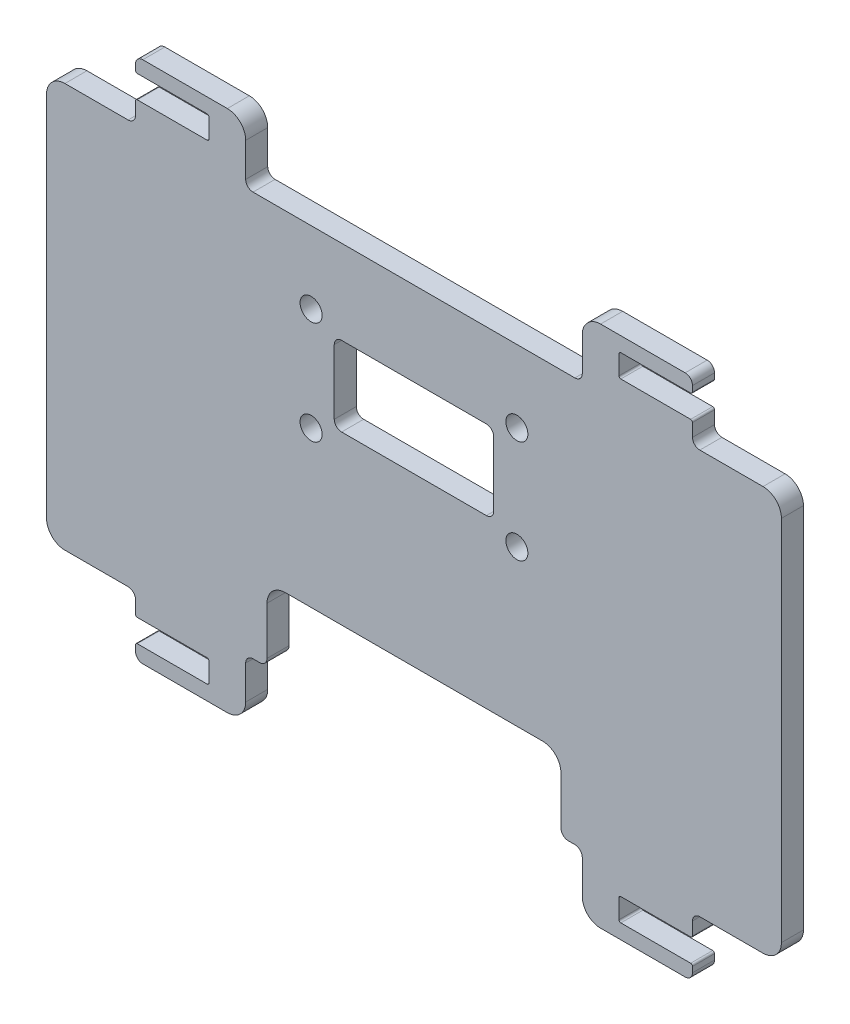
from build123d import *

# Parameters (mm, degrees)
CROQUIS1_R              = 1.5
CROQUIS1_W              = 21.7
CROQUIS1_H              = 10.8
SALIENTE_EXTRUIR1_DEPTH = 3
CORTAR_EXTRUIR2_DEPTH   = 3
REDONDEO1_R             = 1
REDONDEO2_R             = 0.25


with BuildPart() as part:
    # Croquis1 → Saliente-Extruir1 (new body)
    with BuildSketch(Plane.XY):
        with BuildLine():
            Line((-50, 25), (-50, -25))
            ThreePointArc((-50, -25), (-49.267766953, -26.767766953), (-47.5, -27.5))
            Line((-47.5, -27.5), (-37.9, -27.5))
            Line((-37.9, -27.5), (-37.9, -30.5))
            Line((-37.9, -30.5), (-27.9, -30.5))
            Line((-27.9, -30.5), (-27.9, -33.6))
            Line((-27.9, -33.6), (-37.9, -33.6))
            Line((-37.9, -33.6), (-37.9, -35.6))
            Line((-37.9, -35.6), (-25.4, -35.6))
            ThreePointArc((-25.4, -35.6), (-23.632233047, -34.867766953), (-22.9, -33.1))
            Line((-22.9, -33.1), (-22.9, -27.5))
            Line((-22.9, -27.5), (22.9, -27.5))
            Line((22.9, -27.5), (22.9, -33.1))
            ThreePointArc((22.9, -33.1), (23.632233047, -34.867766953), (25.4, -35.6))
            Line((25.4, -35.6), (37.9, -35.6))
            Line((37.9, -35.6), (37.9, -33.6))
            Line((37.9, -33.6), (27.9, -33.6))
            Line((27.9, -33.6), (27.9, -30.5))
            Line((27.9, -30.5), (37.9, -30.5))
            Line((37.9, -30.5), (37.9, -27.5))
            Line((37.9, -27.5), (47.5, -27.5))
            ThreePointArc((47.5, -27.5), (49.267766953, -26.767766953), (50, -25))
            Line((50, -25), (50, 25))
            ThreePointArc((50, 25), (49.267766953, 26.767766953), (47.5, 27.5))
            Line((47.5, 27.5), (37.9, 27.5))
            Line((37.9, 27.5), (37.9, 30.5))
            Line((37.9, 30.5), (27.9, 30.5))
            Line((27.9, 30.5), (27.9, 33.6))
            Line((27.9, 33.6), (37.9, 33.6))
            Line((37.9, 33.6), (37.9, 35.6))
            Line((37.9, 35.6), (25.4, 35.6))
            ThreePointArc((25.4, 35.6), (23.632233047, 34.867766953), (22.9, 33.1))
            Line((22.9, 33.1), (22.9, 27.5))
            Line((22.9, 27.5), (-22.9, 27.5))
            Line((-22.9, 27.5), (-22.9, 33.1))
            ThreePointArc((-22.9, 33.1), (-23.632233047, 34.867766953), (-25.4, 35.6))
            Line((-25.4, 35.6), (-37.9, 35.6))
            Line((-37.9, 35.6), (-37.9, 33.6))
            Line((-37.9, 33.6), (-27.9, 33.6))
            Line((-27.9, 33.6), (-27.9, 30.5))
            Line((-27.9, 30.5), (-37.9, 30.5))
            Line((-37.9, 30.5), (-37.9, 27.5))
            Line((-37.9, 27.5), (-47.5, 27.5))
            ThreePointArc((-47.5, 27.5), (-49.267766953, 26.767766953), (-50, 25))
        make_face()
        with Locations((-14, 17.663397979)):
            Circle(CROQUIS1_R, mode=Mode.SUBTRACT)
        with Locations(Location((14, 17.663397979, 0), (0, 0, 180))):
            Circle(CROQUIS1_R, mode=Mode.SUBTRACT)
        with Locations((14, 3.643397979)):
            Circle(CROQUIS1_R, mode=Mode.SUBTRACT)
        with Locations(Location((-14, 3.643397979, 0), (0, 0, 180))):
            Circle(CROQUIS1_R, mode=Mode.SUBTRACT)
        with Locations((0, 10.653397979)):
            Rectangle(CROQUIS1_W, CROQUIS1_H, mode=Mode.SUBTRACT)
    extrude(amount=SALIENTE_EXTRUIR1_DEPTH)

    # Croquis2 → Cortar-Extruir2 (cut, symmetric)
    with BuildSketch(Plane.XY):
        with BuildLine():
            Line((-17.5, -17.5), (17.5, -17.5))
            ThreePointArc((17.5, -17.5), (19.267766953, -18.232233047), (20, -20))
            Line((20, -20), (20, -37.5))
            Line((20, -37.5), (-20, -37.5))
            Line((-20, -37.5), (-20, -20))
            ThreePointArc((-20, -20), (-19.267766953, -18.232233047), (-17.5, -17.5))
        make_face()
    extrude(amount=CORTAR_EXTRUIR2_DEPTH, both=True, mode=Mode.SUBTRACT)

    # Redondeo1
    redondeo1_edges = [part.edges().sort_by_distance(p)[0] for p in [
        (10.85, 5.253397979, 1.5),
        (10.85, 16.053397979, 1.5),
        (-10.85, 16.053397979, 1.5),
        (-10.85, 5.253397979, 1.5),
        (20, -27.5, 1.5),
        (-20, -27.5, 1.5),
        (-37.9, 27.5, 1.5),
        (-37.9, 35.6, 1.5),
        (-22.9, 27.5, 1.5),
        (22.9, 27.5, 1.5),
        (37.9, 35.6, 1.5),
        (37.9, 27.5, 1.5),
        (37.9, -27.5, 1.5),
        (37.9, -35.6, 1.5),
        (22.9, -27.5, 1.5),
        (-22.9, -27.5, 1.5),
        (-37.9, -35.6, 1.5),
        (-37.9, -27.5, 1.5),
    ]]
    fillet(redondeo1_edges, radius=REDONDEO1_R)

    # Redondeo2
    redondeo2_edges = [part.edges().sort_by_distance(p)[0] for p in [
        (-37.9, 30.5, 1.5),
        (-27.9, 30.5, 1.5),
        (-27.9, 33.6, 1.5),
        (-37.9, 33.6, 1.5),
        (37.9, 33.6, 1.5),
        (27.9, 33.6, 1.5),
        (27.9, 30.5, 1.5),
        (37.9, 30.5, 1.5),
        (37.9, -30.5, 1.5),
        (27.9, -30.5, 1.5),
        (27.9, -33.6, 1.5),
        (37.9, -33.6, 1.5),
        (-37.9, -33.6, 1.5),
        (-27.9, -33.6, 1.5),
        (-27.9, -30.5, 1.5),
        (-37.9, -30.5, 1.5),
    ]]
    fillet(redondeo2_edges, radius=REDONDEO2_R)


solid = part.part
